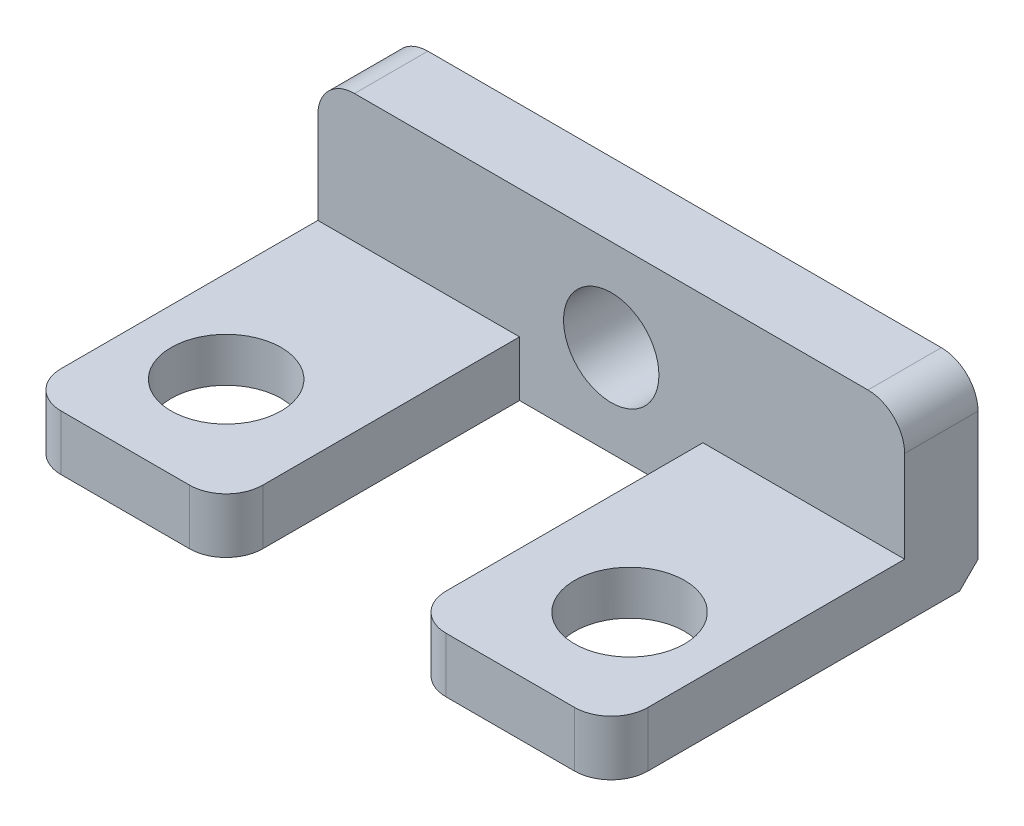
from build123d import *

# Parameters (mm, degrees)
SKETCH_1_W          = 16
SKETCH_1_H          = 5
EXTRUDE_1_DEPTH     = 10
SKETCH_2_W          = 16
SKETCH_2_H          = 3.496194888
CUT_EXTRUDE_1_DEPTH = 8
SKETCH_4_W          = 5
SKETCH_4_H          = 1.503805112
CUT_EXTRUDE_3_DEPTH = 8
SKETCH_3_R          = 1.3
CUT_EXTRUDE_2_DEPTH = 2
SKETCH_5_R          = 1.5
CUT_EXTRUDE_5_DEPTH = 2
SKETCH_6_R          = 2
CUT_EXTRUDE_6_DEPTH = 0.3
FILLET_1_R          = 1
FILLET_2_R          = 1
CHAMFER_1_SIZE      = 0.5


with BuildPart() as part:
    # 草图1 → 凸台-拉伸1 (new body)
    with BuildSketch(Plane.XY):
        with Locations((8, 2.5)):
            Rectangle(SKETCH_1_W, SKETCH_1_H)
    extrude(amount=EXTRUDE_1_DEPTH)

    # 草图2 → 切除-拉伸1 (cut)
    with BuildSketch(Plane.XY.offset(10)):
        with Locations((8, 3.251902556)):
            Rectangle(SKETCH_2_W, SKETCH_2_H)
    extrude(amount=-CUT_EXTRUDE_1_DEPTH, mode=Mode.SUBTRACT)

    # 草图4 → 切除-拉伸3 (cut)
    with BuildSketch(Plane.XY.offset(10)):
        with Locations((8, 0.751902556)):
            Rectangle(SKETCH_4_W, SKETCH_4_H)
    extrude(amount=-CUT_EXTRUDE_3_DEPTH, mode=Mode.SUBTRACT)

    # 草图3 → 切除-拉伸2 (cut)
    with BuildSketch(Plane.XY.offset(2)):
        with Locations((8, 2.5)):
            Circle(SKETCH_3_R)
    extrude(amount=-CUT_EXTRUDE_2_DEPTH, mode=Mode.SUBTRACT)

    # 草图5 → 切除-拉伸5 (cut)
    with BuildSketch(Plane.XZ):
        with Locations(Location((2.5, 7, 0), (0, 0, 270))):
            Circle(SKETCH_5_R)
        with Locations(Location((13.5, 7, 0), (0, 0, 270))):
            Circle(SKETCH_5_R)
    extrude(amount=-CUT_EXTRUDE_5_DEPTH, mode=Mode.SUBTRACT)

    # 草图6 → 切除-拉伸6 (cut)
    with BuildSketch(Plane.XZ):
        with Locations(Location((2.5, 7, 0), (0, 0, 270))):
            Circle(SKETCH_6_R)
        with Locations(Location((13.5, 7, 0), (0, 0, 270))):
            Circle(SKETCH_6_R)
    extrude(amount=-CUT_EXTRUDE_6_DEPTH, mode=Mode.SUBTRACT)

    # 圆角1
    fillet_1_edges = [part.edges().sort_by_distance(p)[0] for p in [
        (0, 5, 1),
        (16, 5, 1),
    ]]
    fillet(fillet_1_edges, radius=FILLET_1_R)

    # 圆角2
    fillet_2_edges = [part.edges().sort_by_distance(p)[0] for p in [
        (16, 0.751902556, 10),
        (0, 0.751902556, 10),
        (5.5, 0.751902556, 10),
        (10.5, 0.751902556, 10),
    ]]
    fillet(fillet_2_edges, radius=FILLET_2_R)

    # 倒角1
    chamfer_1_edges = [part.edges().sort_by_distance(p)[0] for p in [
        (8, 0, 0),
    ]]
    chamfer(chamfer_1_edges, length=CHAMFER_1_SIZE)


solid = part.part
